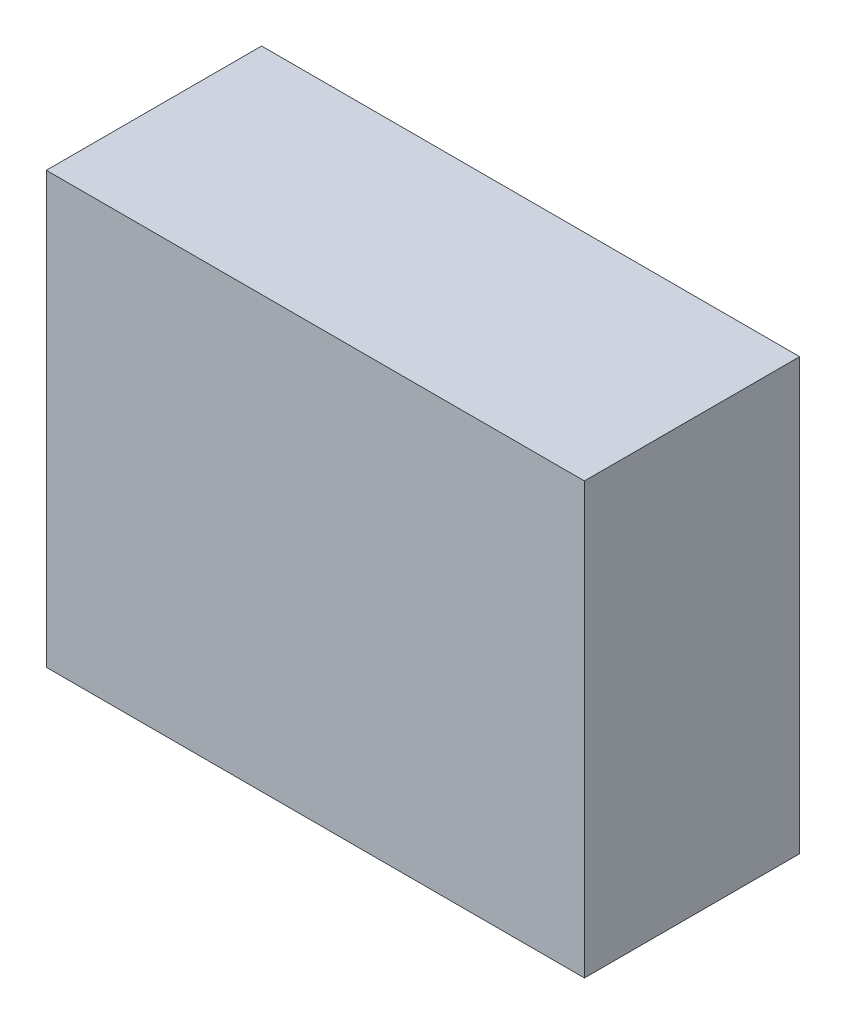
from build123d import *

# Parameters (mm, degrees)
SKETCH_1_W      = 25
SKETCH_1_H      = 20
EXTRUDE_1_DEPTH = 10


with BuildPart() as part:
    # 草图1 → 凸台-拉伸1 (new body)
    with BuildSketch(Plane.XY):
        with Locations((12.5, 10)):
            Rectangle(SKETCH_1_W, SKETCH_1_H)
    extrude(amount=EXTRUDE_1_DEPTH)


solid = part.part
